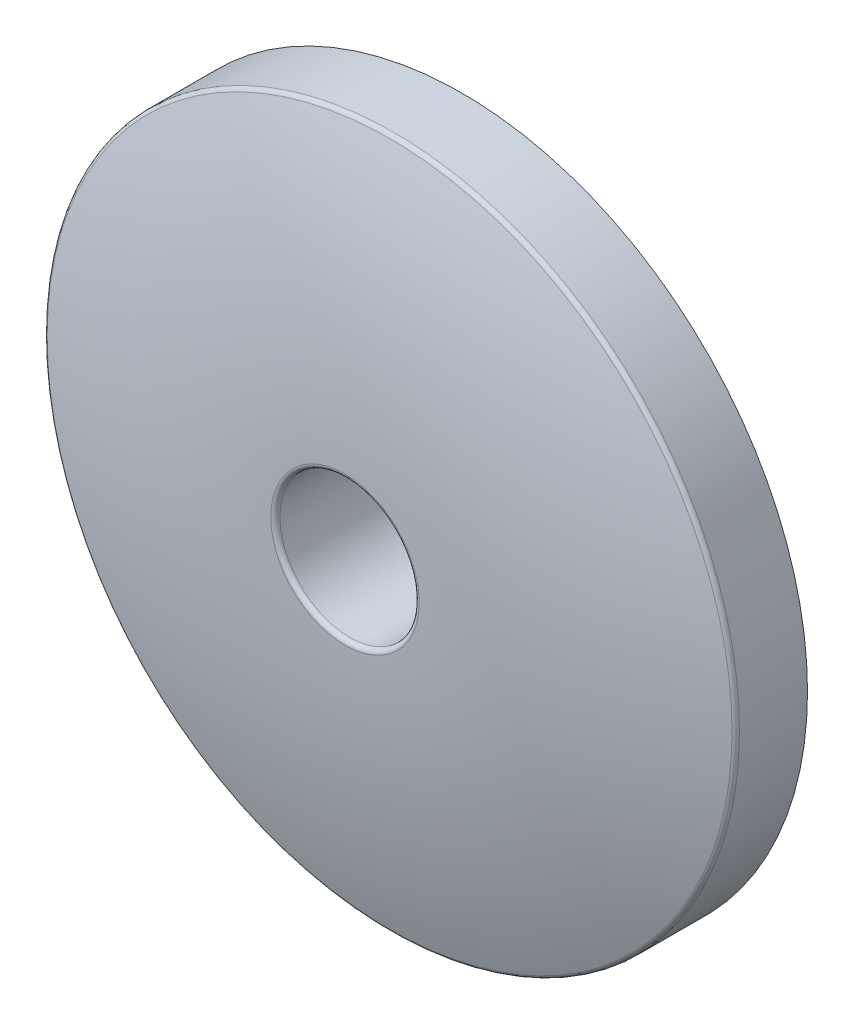
from build123d import *


with BuildPart() as part:
    # Sk_flange_section → Rev_flange (revolve)
    with BuildSketch(Plane(origin=(0, -19.05, 0), x_dir=(1, 0, 0), z_dir=(0, 1, 0)), mode=Mode.PRIVATE) as rev_flange_sk:
        with BuildLine():
            Line((46.228, -7.9375), (76.93025, -7.9375))
            Line((76.93025, -7.9375), (76.93025, -15.50924))
            ThreePointArc((76.93025, -15.50924), (76.834622271, -15.805910462), (76.584339104, -15.991696258))
            ThreePointArc((76.584339104, -15.991696258), (61.859650948, -19.664260346), (46.738726881, -20.953377723))
            ThreePointArc((46.738726881, -20.953377723), (46.377236954, -20.805422618), (46.228, -20.44446))
            Line((46.228, -20.44446), (46.228, -7.9375))
        make_face()
    revolve(rev_flange_sk.sketch.rotate(Axis((38.481, -19.05, -50.8), (0, 0, 1)), 180), axis=Axis((38.481, -19.05, -50.8), (0, 0, 1)))


solid = part.part
